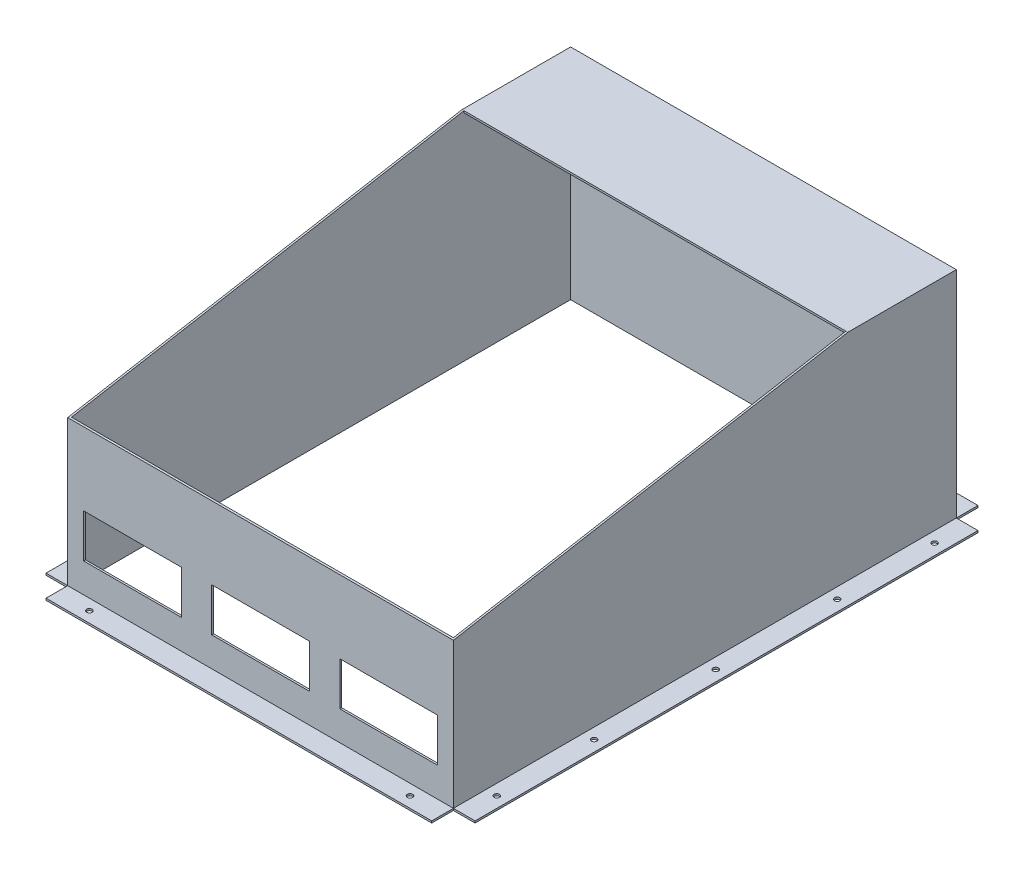
from build123d import *

# Parameters (mm, degrees)
CROQUIS1_W              = 355.5
CROQUIS1_H              = 463.5
SALIENTE_EXTRUIR1_DEPTH = 200
CROQUIS2_W              = 352
CROQUIS2_H              = 460
CORTAR_EXTRUIR1_DEPTH   = 300
CORTAR_EXTRUIR2_DEPTH   = 470.135707978
CROQUIS4_W              = 463.5
CROQUIS4_H              = 1.75
SALIENTE_EXTRUIR2_DEPTH = 20
CROQUIS5_W              = 463.5
CROQUIS5_H              = 1.75
SALIENTE_EXTRUIR3_DEPTH = 20
CROQUIS6_W              = 355.5
CROQUIS6_H              = 1.75
SALIENTE_EXTRUIR4_DEPTH = 20
CROQUIS7_W              = 355.5
CROQUIS7_H              = 1.75
SALIENTE_EXTRUIR5_DEPTH = 20
CROQUIS8_R              = 2.5
CORTAR_EXTRUIR3_DEPTH   = 20
CROQUIS9_W              = 90
CROQUIS9_H              = 40
CORTAR_EXTRUIR4_DEPTH   = 20
CROQUIS10_W             = 352
CROQUIS10_H             = 1.75
SALIENTE_EXTRUIR6_DEPTH = 98.25


with BuildPart() as part:
    # Croquis1 → Saliente-Extruir1 (new body)
    with BuildSketch(Plane(origin=(0, 0, 0), x_dir=(1, 0, 0), z_dir=(0, 1, 0))):
        Rectangle(CROQUIS1_W, CROQUIS1_H)
    extrude(amount=SALIENTE_EXTRUIR1_DEPTH)

    # Croquis2 → Cortar-Extruir1 (cut)
    with BuildSketch(Plane(origin=(0, 200, 0), x_dir=(1, 0, 0), z_dir=(0, 1, 0))):
        Rectangle(CROQUIS2_W, CROQUIS2_H)
    extrude(amount=-CORTAR_EXTRUIR1_DEPTH, mode=Mode.SUBTRACT)

    # Croquis3 → Cortar-Extruir2 (cut, through all)
    with BuildSketch(Plane.ZY.offset(177.75)):
        Polygon((-131.75, 200), (231.75, 135.905142512), (231.75, 200), align=None)
    extrude(amount=-CORTAR_EXTRUIR2_DEPTH, mode=Mode.SUBTRACT)

    # Croquis4 → Saliente-Extruir2 (add)
    with BuildSketch(Plane.ZY.offset(177.75)):
        with Locations((0, 0.875)):
            Rectangle(CROQUIS4_W, CROQUIS4_H)
    extrude(amount=SALIENTE_EXTRUIR2_DEPTH)

    # Croquis5 → Saliente-Extruir3 (add)
    with BuildSketch(Plane(origin=(177.75, 0, 0), x_dir=(0, 0, -1), z_dir=(1, 0, 0))):
        with Locations((0, 0.875)):
            Rectangle(CROQUIS5_W, CROQUIS5_H)
    extrude(amount=SALIENTE_EXTRUIR3_DEPTH)

    # Croquis6 → Saliente-Extruir4 (add)
    with BuildSketch(Plane(origin=(0, 0, -231.75), x_dir=(-1, 0, 0), z_dir=(0, 0, -1))):
        with Locations((0, 0.875)):
            Rectangle(CROQUIS6_W, CROQUIS6_H)
    extrude(amount=SALIENTE_EXTRUIR4_DEPTH)

    # Croquis7 → Saliente-Extruir5 (add)
    with BuildSketch(Plane.XY.offset(231.75)):
        with Locations((0, 0.875)):
            Rectangle(CROQUIS7_W, CROQUIS7_H)
    extrude(amount=SALIENTE_EXTRUIR5_DEPTH)

    # Croquis8 → Cortar-Extruir3 (cut)
    with BuildSketch(Plane(origin=(0, 1.75, 0), x_dir=(1, 0, 0), z_dir=(0, 1, 0))):
        with Locations(Location((-187.75, 201.75, 0), (0, 0, 270))):
            Circle(CROQUIS8_R)
        with Locations(Location((-187.75, 0, 0), (0, 0, 270))):
            Circle(CROQUIS8_R)
        with Locations(Location((-187.75, 112, 0), (0, 0, 270))):
            Circle(CROQUIS8_R)
        with Locations(Location((187.75, 201.75, 0), (0, 0, 270))):
            Circle(CROQUIS8_R)
        with Locations(Location((187.75, 112, 0), (0, 0, 270))):
            Circle(CROQUIS8_R)
        with Locations(Location((187.75, 0, 0), (0, 0, 270))):
            Circle(CROQUIS8_R)
        with Locations(Location((-187.75, -201.75, 0), (0, 0, 270))):
            Circle(CROQUIS8_R)
        with Locations(Location((-187.75, -112, 0), (0, 0, 270))):
            Circle(CROQUIS8_R)
        with Locations(Location((187.75, -112, 0), (0, 0, 270))):
            Circle(CROQUIS8_R)
        with Locations(Location((187.75, -201.75, 0), (0, 0, 270))):
            Circle(CROQUIS8_R)
        with Locations(Location((0, 241.75, 0), (0, 0, 270))):
            Circle(CROQUIS8_R)
        with Locations(Location((147.75, 241.75, 0), (0, 0, 270))):
            Circle(CROQUIS8_R)
        with Locations(Location((-147.75, 241.75, 0), (0, 0, 270))):
            Circle(CROQUIS8_R)
        with Locations(Location((147.75, -241.75, 0), (0, 0, 270))):
            Circle(CROQUIS8_R)
        with Locations(Location((-147.75, -241.75, 0), (0, 0, 270))):
            Circle(CROQUIS8_R)
    extrude(amount=-CORTAR_EXTRUIR3_DEPTH, mode=Mode.SUBTRACT)

    # Croquis9 → Cortar-Extruir4 (cut)
    with BuildSketch(Plane.XY.offset(231.75)):
        with Locations((118, 48.827571256)):
            Rectangle(CROQUIS9_W, CROQUIS9_H)
        with Locations((0, 48.827571256)):
            Rectangle(CROQUIS9_W, CROQUIS9_H)
        with Locations((-118, 48.827571256)):
            Rectangle(CROQUIS9_W, CROQUIS9_H)
    extrude(amount=-CORTAR_EXTRUIR4_DEPTH, mode=Mode.SUBTRACT)

    # Croquis10 → Saliente-Extruir6 (add)
    with BuildSketch(Plane.XY.offset(-230)):
        with Locations((0, 199.125)):
            Rectangle(CROQUIS10_W, CROQUIS10_H)
    extrude(amount=SALIENTE_EXTRUIR6_DEPTH)


solid = part.part
